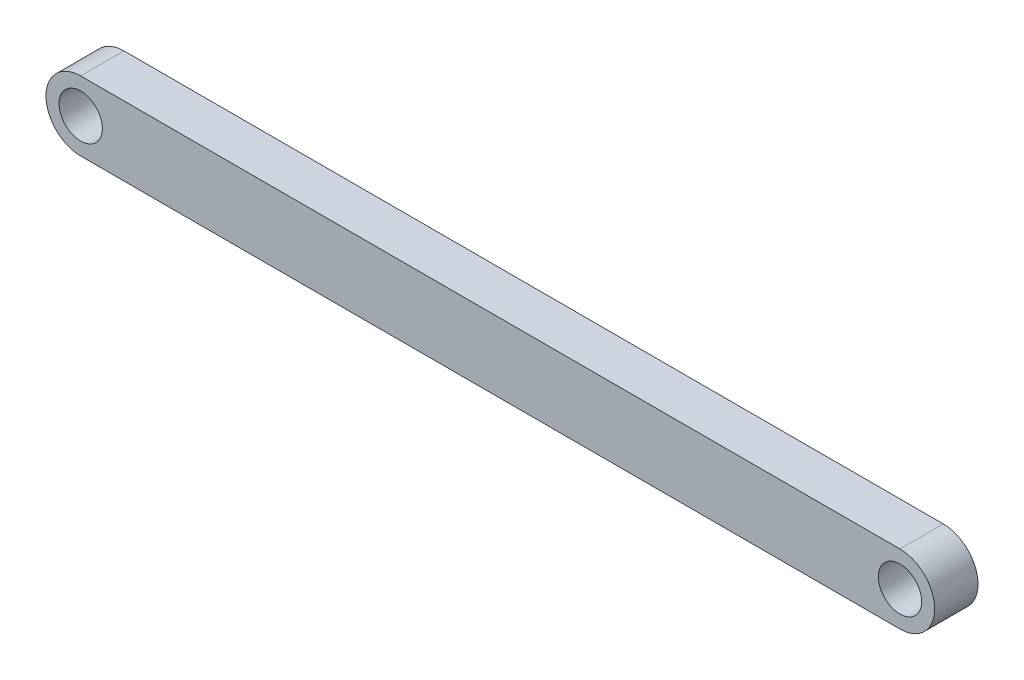
from build123d import *

# Parameters (mm, degrees)
SKETCH1_R           = 5
BOSS_EXTRUDE1_DEPTH = 5
CUT_EXTRUDE1_DEPTH  = 6


with BuildPart() as part:
    # Sketch1 → Boss-Extrude1 (new, symmetric)
    with BuildSketch(Plane.XY):
        with BuildLine():
            Line((-94.5, 8), (94.5, 8))
            ThreePointArc((94.5, 8), (102.5, 0), (94.5, -8))
            Line((94.5, -8), (-94.5, -8))
            ThreePointArc((-94.5, -8), (-102.5, 0), (-94.5, 8))
        make_face()
        with Locations((-94.5, 0)):
            Circle(SKETCH1_R, mode=Mode.SUBTRACT)
        with Locations(Location((94.5, 0, 0), (0, 0, 180))):
            Circle(SKETCH1_R, mode=Mode.SUBTRACT)
    extrude(amount=BOSS_EXTRUDE1_DEPTH, both=True)

    # Sketch2 → Cut-Extrude1 (cut)
    with BuildSketch(Plane(origin=(0, 0, -5), x_dir=(-1, 0, 0), z_dir=(0, 0, -1))):
        with BuildLine():
            Line((-74.5, 4), (74.5, 4))
            ThreePointArc((74.5, 4), (78.5, 0), (74.5, -4))
            Line((74.5, -4), (-74.5, -4))
            ThreePointArc((-74.5, -4), (-78.5, 0), (-74.5, 4))
        make_face()
    extrude(amount=-CUT_EXTRUDE1_DEPTH, mode=Mode.SUBTRACT)


solid = part.part
